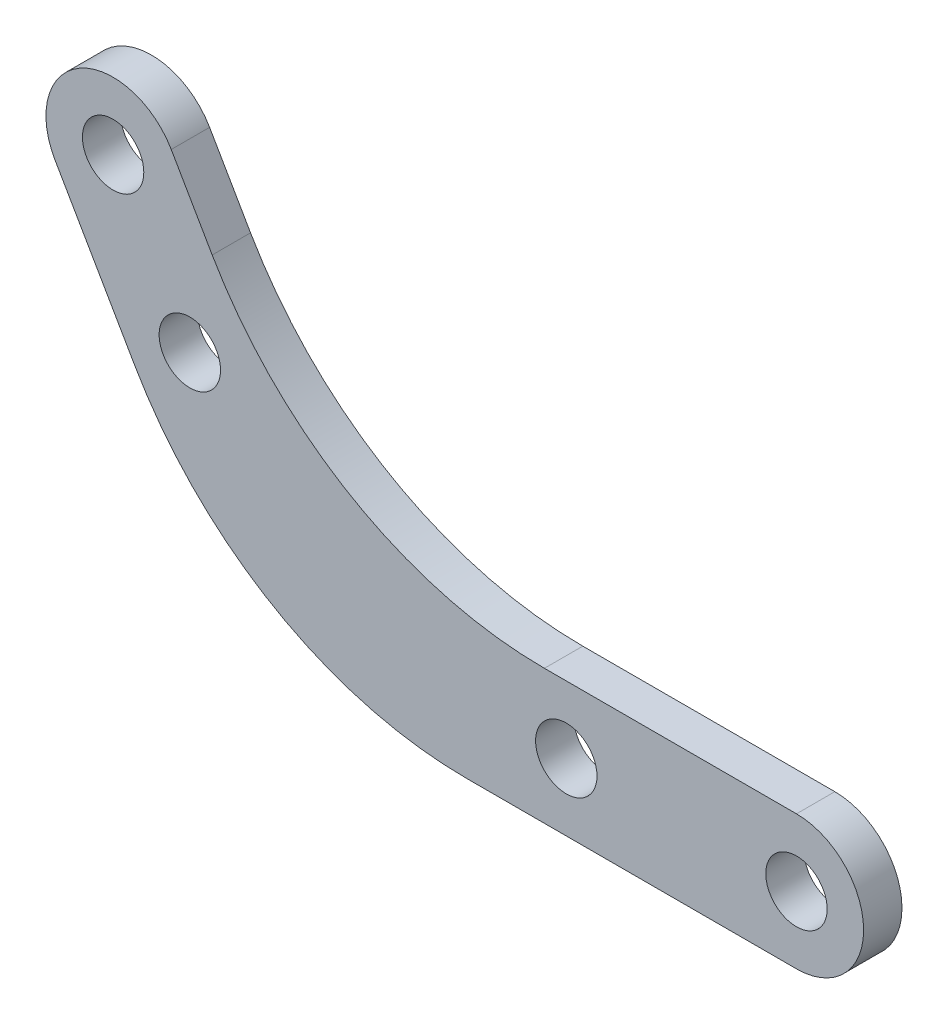
from build123d import *

# Parameters (mm, degrees)
SKETCH_1_R      = 1.6
EXTRUDE_1_DEPTH = 2
FILLET_1_R      = 20


with BuildPart() as part:
    # ｽｹｯﾁ1 → ﾎﾞｽ - 押し出し1 (new body)
    with BuildSketch(Plane.XY):
        with BuildLine():
            ThreePointArc((87, 38.5), (90.5, 35), (87, 31.5))
            Line((87, 31.5), (58.272014636, 31.5))
            Line((58.272014636, 31.5), (48.343911087, 48.69597977))
            ThreePointArc((48.343911087, 48.69597977), (49.625, 53.477068684), (54.406088913, 52.19597977))
            Line((54.406088913, 52.19597977), (62.313466521, 38.5))
            Line((62.313466521, 38.5), (87, 38.5))
        make_face()
        with Locations((87, 35)):
            Circle(SKETCH_1_R, mode=Mode.SUBTRACT)
        with Locations((75, 35)):
            Circle(SKETCH_1_R, mode=Mode.SUBTRACT)
        with Locations((55.375, 43.51777654)):
            Circle(SKETCH_1_R, mode=Mode.SUBTRACT)
        with Locations((51.375, 50.44597977)):
            Circle(SKETCH_1_R, mode=Mode.SUBTRACT)
    extrude(amount=EXTRUDE_1_DEPTH)

    # ﾌｨﾚｯﾄ1
    fillet_1_edges = [part.edges().sort_by_distance(p)[0] for p in [
        (58.272014636, 31.5, 1),
        (62.313466521, 38.5, 1),
    ]]
    fillet(fillet_1_edges, radius=FILLET_1_R)


solid = part.part
